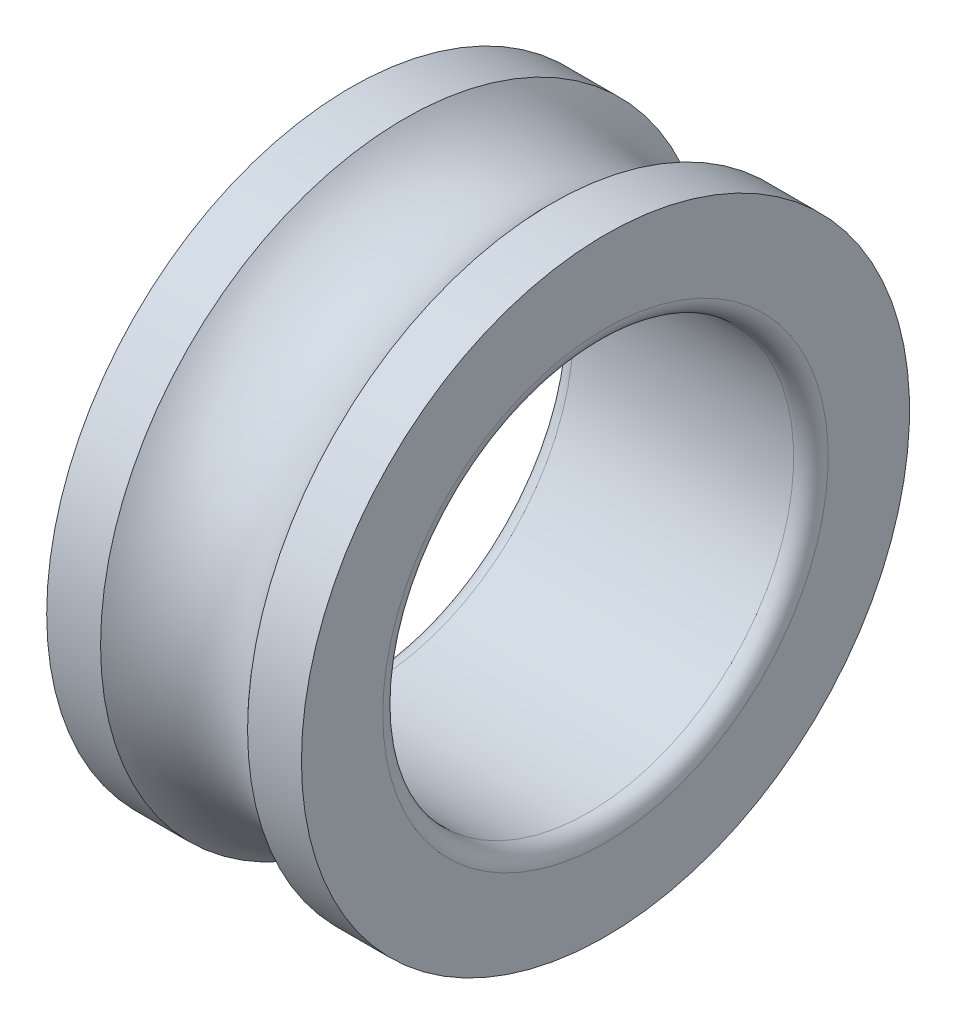
from build123d import *


with BuildPart() as part:
    # Sketch1 → Revolve1 (revolve)
    with BuildSketch(Plane.XY, mode=Mode.PRIVATE) as revolve1_sk:
        with BuildLine():
            Line((-15.5, 37), (-8.94427191, 37))
            ThreePointArc((-8.94427191, 37), (0, 33), (8.94427191, 37))
            Line((8.94427191, 37), (15.5, 37))
            Line((15.5, 37), (15.5, 27.1))
            ThreePointArc((15.5, 27.1), (14.88492424, 25.61507576), (13.4, 25))
            Line((13.4, 25), (-13.4, 25))
            ThreePointArc((-13.4, 25), (-14.88492424, 25.61507576), (-15.5, 27.1))
            Line((-15.5, 27.1), (-15.5, 37))
        make_face()
    revolve(revolve1_sk.sketch.rotate(Axis((0, 0, 0), (1, 0, 0)), 90), axis=Axis((0, 0, 0), (1, 0, 0)))


solid = part.part
